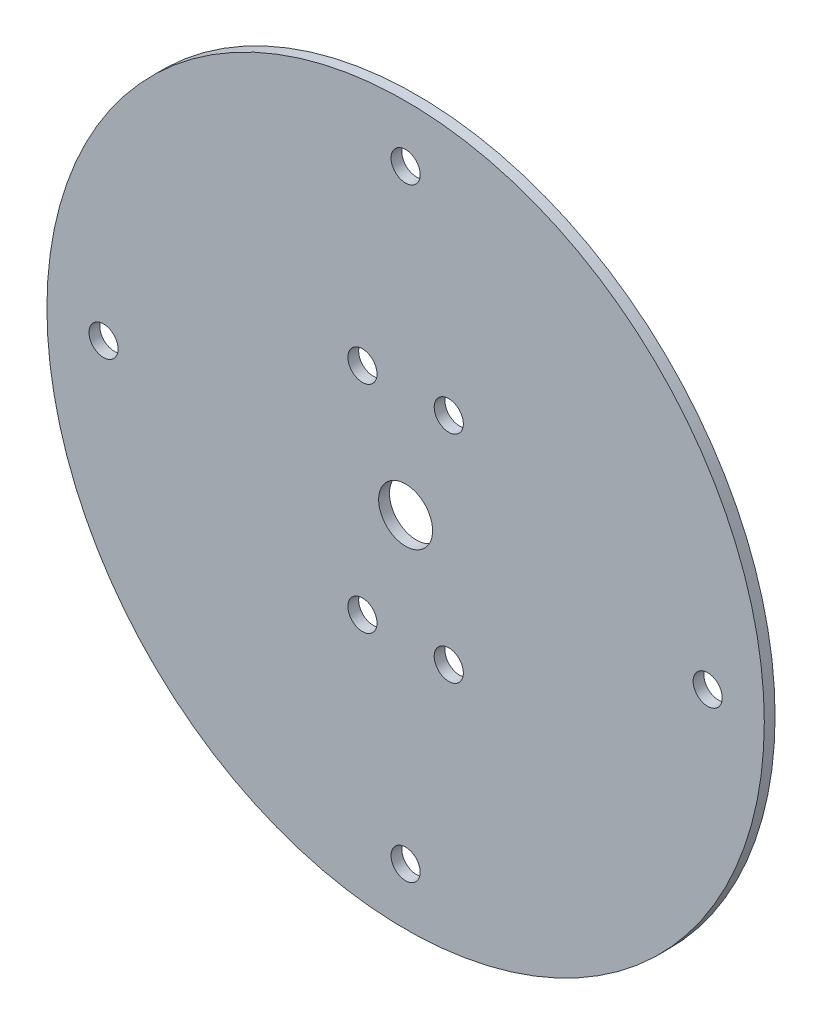
from build123d import *

# Parameters (mm, degrees)
SKETCH1_R           = 84.455
BOSS_EXTRUDE1_DEPTH = 2.54
SKETCH2_R           = 3.429
CUT_EXTRUDE1_DEPTH  = 2.54
SKETCH3_R           = 6.35
CUT_EXTRUDE2_DEPTH  = 2.54
SKETCH4_R           = 3.429
CUT_EXTRUDE3_DEPTH  = 120.464411646
CIRPATTERN1_COUNT   = 4


with BuildPart() as part:
    # Sketch1 → Boss-Extrude1 (new body)
    with BuildSketch(Plane.XY):
        Circle(SKETCH1_R)
    extrude(amount=BOSS_EXTRUDE1_DEPTH)

    # Sketch2 → Cut-Extrude1 (cut)
    with BuildSketch(Plane.XY.offset(2.54)):
        with Locations((-10.16, 25.4)):
            Circle(SKETCH2_R)
        with Locations(Location((10.16, 25.4, 0), (0, 0, 180))):
            Circle(SKETCH2_R)
        with Locations((10.16, -25.4)):
            Circle(SKETCH2_R)
        with Locations(Location((-10.16, -25.4, 0), (0, 0, 180))):
            Circle(SKETCH2_R)
    extrude(amount=-CUT_EXTRUDE1_DEPTH, mode=Mode.SUBTRACT)

    # Sketch3 → Cut-Extrude2 (cut)
    with BuildSketch(Plane.XY.offset(2.54)):
        Circle(SKETCH3_R)
    extrude(amount=-CUT_EXTRUDE2_DEPTH, mode=Mode.SUBTRACT)

    # Sketch4 → Cut-Extrude3 (cut, through all)
    with BuildSketch(Plane(origin=(0, 0, 0), x_dir=(-1, 0, 0), z_dir=(0, 0, -1))):
        with Locations((71.12, 0)):
            Circle(SKETCH4_R)
    cut_extrude3 = extrude(amount=-CUT_EXTRUDE3_DEPTH, mode=Mode.SUBTRACT)

    # CirPattern1: Cut-Extrude3 ×4 about axis
    cirpattern1_axis = Axis((0, 0, 0), (0, 0, 1))
    for i in range(1, CIRPATTERN1_COUNT):
        add(cut_extrude3.rotate(cirpattern1_axis, i * 360 / CIRPATTERN1_COUNT), mode=Mode.SUBTRACT)


solid = part.part
